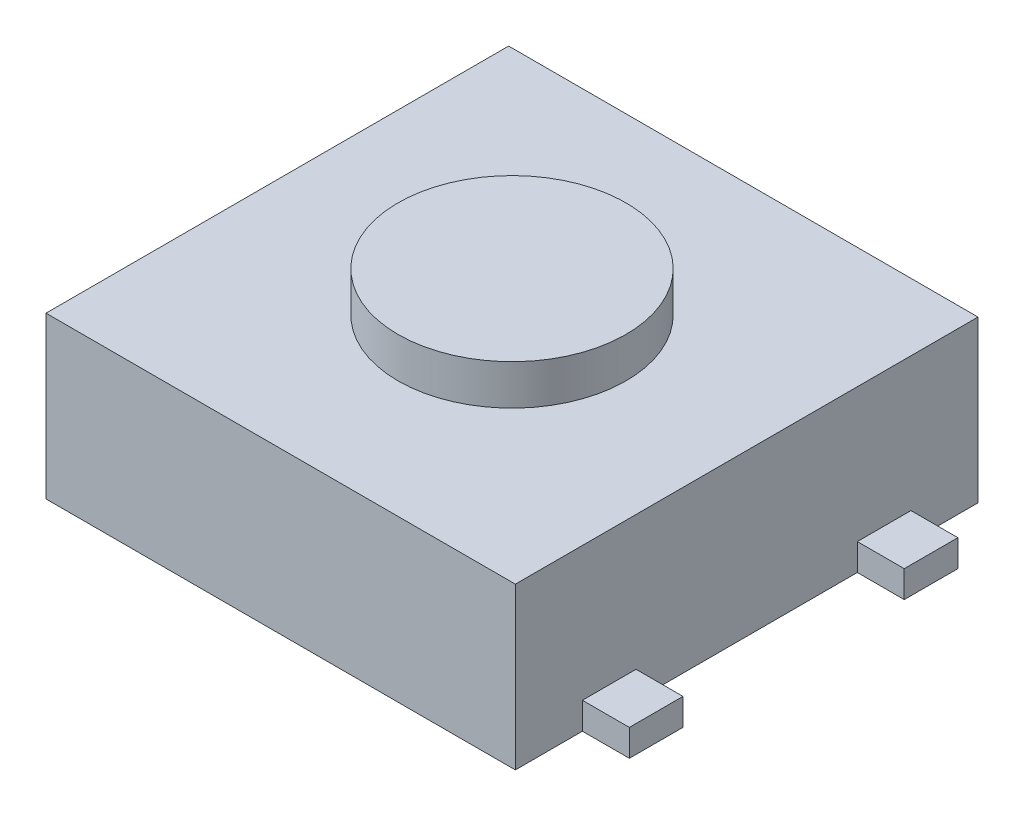
from build123d import *

# Parameters (mm, degrees)
SKETCH_2_W          = 3.5
SKETCH_2_H          = 3.45
EXTRUDE_1_DEPTH     = 1.5
SKETCH_3_W          = 0.35
SKETCH_3_H          = 0.4
EXTRUDE_2_DEPTH     = 0.2
SKETCH_4_W          = 3.5
SKETCH_4_H          = 3.45
SKETCH_4_R          = 0.85
CUT_EXTRUDE_1_DEPTH = 0.3


with BuildPart() as part:
    # Эскиз2 → Бобышка-Вытянуть1 (new body)
    with BuildSketch(Plane(origin=(0, 0, 0), x_dir=(1, 0, 0), z_dir=(0, 1, 0))):
        Rectangle(SKETCH_2_W, SKETCH_2_H)
    extrude(amount=EXTRUDE_1_DEPTH)

    # Эскиз3 → Бобышка-Вытянуть2 (add)
    with BuildSketch(Plane(origin=(0, 0, 0), x_dir=(-1, 0, 0), z_dir=(0, -1, 0))):
        with Locations((1.925, -1.025)):
            Rectangle(SKETCH_3_W, SKETCH_3_H)
        with Locations((1.925, 1.025)):
            Rectangle(SKETCH_3_W, SKETCH_3_H)
        with Locations((-1.925, -1.025)):
            Rectangle(SKETCH_3_W, SKETCH_3_H)
        with Locations((-1.925, 1.025)):
            Rectangle(SKETCH_3_W, SKETCH_3_H)
    extrude(amount=-EXTRUDE_2_DEPTH)

    # Эскиз4 → Вырез-Вытянуть1 (cut)
    with BuildSketch(Plane(origin=(0, 1.5, 0), x_dir=(1, 0, 0), z_dir=(0, 1, 0))):
        Rectangle(SKETCH_4_W, SKETCH_4_H)
        with Locations(Location((0, 0, 0), (0, 0, 270))):
            Circle(SKETCH_4_R, mode=Mode.SUBTRACT)
    extrude(amount=-CUT_EXTRUDE_1_DEPTH, mode=Mode.SUBTRACT)


solid = part.part
